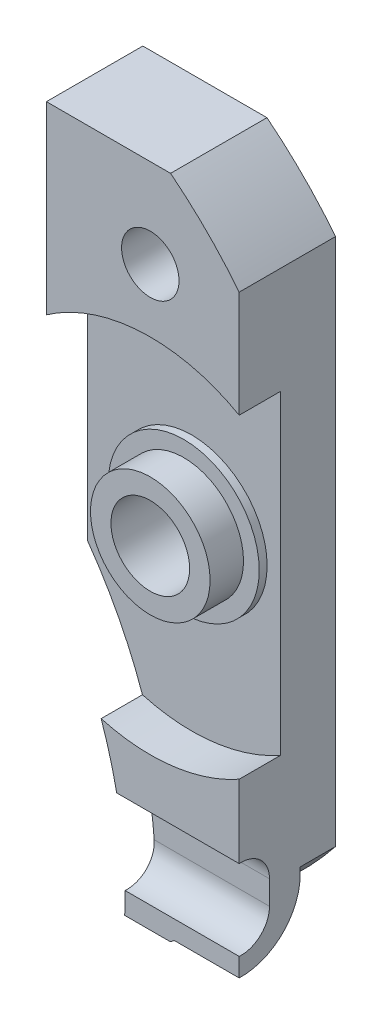
from build123d import *

# Parameters (mm, degrees)
SKETCH1_W           = 12.25
SKETCH1_H           = 42.3
BOSS_EXTRUDE1_DEPTH = 6.125
SKETCH2_R           = 1.825
SKETCH2_R_2         = 2.5
CUT_EXTRUDE1_DEPTH  = 23.855059615
CUT_EXTRUDE2_DEPTH  = 23.855059615
SKETCH4_R           = 11.5
CUT_EXTRUDE3_DEPTH  = 2.625
BOSS_EXTRUDE2_START = 0.5
SKETCH5_R           = 4.8
SKETCH5_R_2         = 2.5
BOSS_EXTRUDE2_DEPTH = 0.5
BOSS_EXTRUDE3_START = 2.125
SKETCH6_R           = 3.8
SKETCH6_R_2         = 2.5
BOSS_EXTRUDE3_DEPTH = 2.125
BOSS_EXTRUDE4_REACH = 27.197
CUT_EXTRUDE4_DEPTH  = 26.19723458


with BuildPart() as part:
    # Sketch1 → Boss-Extrude1 (new body)
    with BuildSketch(Plane.XY):
        Rectangle(SKETCH1_W, SKETCH1_H)
    extrude(amount=BOSS_EXTRUDE1_DEPTH)

    # Sketch2 → Cut-Extrude1 (cut, through all)
    with BuildSketch(Plane.XY.offset(6.125)):
        with Locations((0.475, 15.5)):
            Circle(SKETCH2_R)
        with Locations((0.475, 0)):
            Circle(SKETCH2_R_2)
    extrude(amount=-CUT_EXTRUDE1_DEPTH, mode=Mode.SUBTRACT)

    # Sketch3 → Cut-Extrude2 (cut, through all)
    with BuildSketch(Plane.XY.offset(6.125)):
        with BuildLine():
            Line((-6.125, -21.15), (-1.151863079, -21.15))
            ThreePointArc((-1.151863079, -21.15), (-2.238128282, -12.336341525), (-6.125, -4.351807973))
            Line((-6.125, -4.351807973), (-6.125, -21.15))
        make_face()
        with BuildLine():
            Line((6.125, 21.15), (1.764842259, 21.15))
            ThreePointArc((1.764842259, 21.15), (4.069800152, 19.094796032), (6.125, 16.789834467))
            Line((6.125, 16.789834467), (6.125, 21.15))
        make_face()
        with BuildLine():
            Line((6.125, -21.15), (1.757457575, -21.15))
            ThreePointArc((1.757457575, -21.15), (4.066466825, -19.092268783), (6.125, -16.783974467))
            Line((6.125, -16.783974467), (6.125, -21.15))
        make_face()
    extrude(amount=-CUT_EXTRUDE2_DEPTH, mode=Mode.SUBTRACT)

    # Sketch4 → Cut-Extrude3 (cut)
    with BuildSketch(Plane.XY.offset(6.125)):
        with Locations((0.475, 0)):
            Circle(SKETCH4_R)
    extrude(amount=-CUT_EXTRUDE3_DEPTH, mode=Mode.SUBTRACT)

    # Sketch5 → Boss-Extrude2 (add)
    with BuildSketch(Plane.XY.offset(3.5).offset(BOSS_EXTRUDE2_START)):
        with Locations((0.475, 0)):
            Circle(SKETCH5_R)
        with Locations((0.475, 0)):
            Circle(SKETCH5_R_2, mode=Mode.SUBTRACT)
    extrude(amount=-BOSS_EXTRUDE2_DEPTH)

    # Sketch6 → Boss-Extrude3 (add)
    with BuildSketch(Plane.XY.offset(4).offset(BOSS_EXTRUDE3_START)):
        with Locations((0.475, 0)):
            Circle(SKETCH6_R)
        with Locations((0.475, 0)):
            Circle(SKETCH6_R_2, mode=Mode.SUBTRACT)
    extrude(amount=-BOSS_EXTRUDE3_DEPTH)

    # Sketch7 → Boss-Extrude4 (add, up to next)
    with BuildSketch(Plane(origin=(6.125, 0, 0), x_dir=(0, 0, -1), z_dir=(1, 0, 0)), mode=Mode.PRIVATE) as boss_extrude4_sk1:
        with BuildLine():
            Line((-6.125, -13.462065527), (-6.125, -20.957897703))
            ThreePointArc((-6.125, -20.957897703), (-2.25, -17.209981615), (-6.125, -13.462065527))
        make_face()
    boss_extrude4_tool1 = extrude(boss_extrude4_sk1.sketch, amount=-BOSS_EXTRUDE4_REACH, mode=Mode.PRIVATE) - part.part
    add(boss_extrude4_tool1.solids().sort_by_distance((6.125, -17.209982, 4.47578))[0])

    # Sketch8 → Cut-Extrude4 (cut, through all)
    with BuildSketch(Plane(origin=(6.125, 0, 0), x_dir=(0, 0, -1), z_dir=(1, 0, 0))):
        with BuildLine():
            Line((-7.8, -17.973571615), (-7.8, -16.459481615))
            ThreePointArc((-7.8, -16.459481615), (-6, -14.659481615), (-4.2, -16.459481615))
            Line((-4.2, -16.459481615), (-4.2, -17.973571615))
            ThreePointArc((-4.2, -17.973571615), (-6, -19.773571615), (-7.8, -17.973571615))
        make_face()
    extrude(amount=-CUT_EXTRUDE4_DEPTH, mode=Mode.SUBTRACT)


solid = part.part
